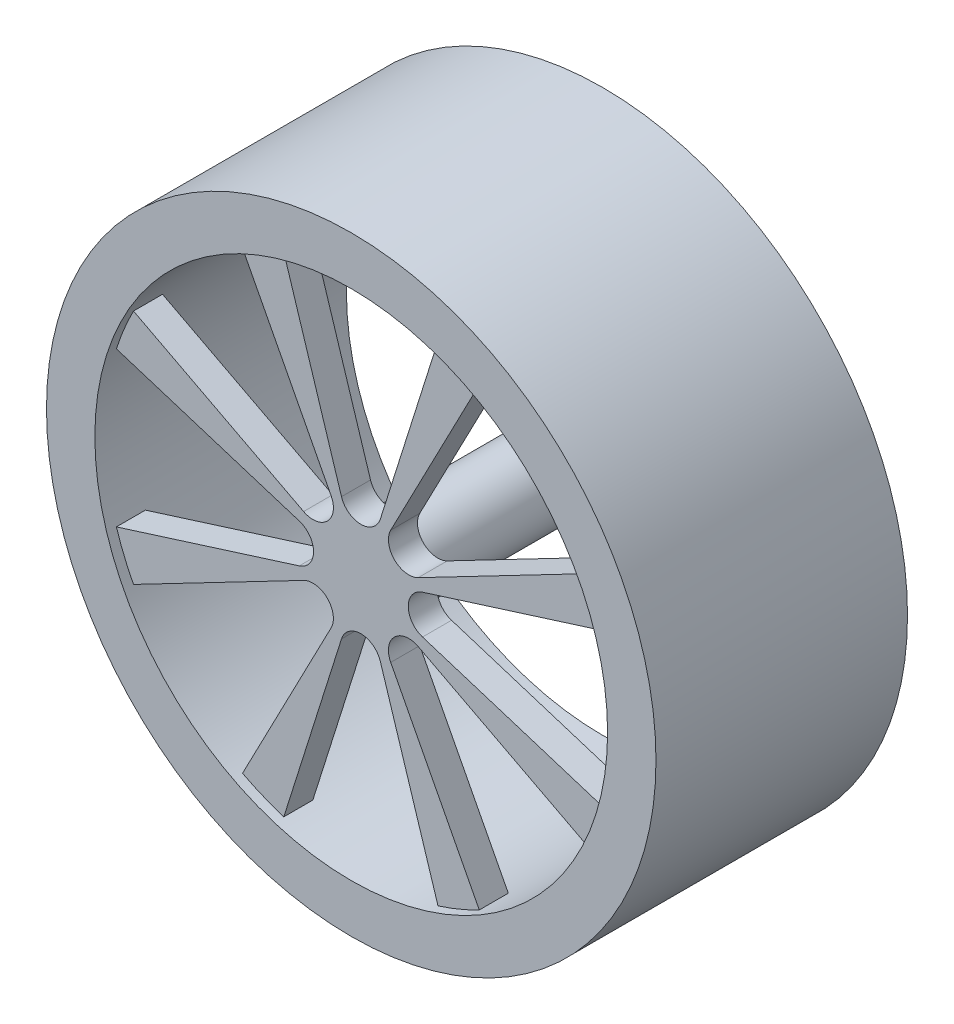
from build123d import *

# Parameters (mm, degrees)
ESQUISSE1_R             = 31.5
BOSS_EXTRU_1_DEPTH      = 26
ESQUISSE2_R             = 26.5
ENL_V_MAT_EXTRU_1_DEPTH = 1
ENL_V_MAT_EXTRU_2_DEPTH = 52.083265362
ESQUISSE4_R             = 26.5
ENL_V_MAT_EXTRU_3_DEPTH = 21
ESQUISSE5_R             = 4
BOSS_EXTRU_2_DEPTH      = 22
ESQUISSE6_R             = 2
ENL_V_MAT_EXTRU_4_DEPTH = 5


with BuildPart() as part:
    # Esquisse1 → Boss.-Extru.1 (new body)
    with BuildSketch(Plane.XY):
        with Locations(Location((0, 0, 0), (0, 0, 180))):
            Circle(ESQUISSE1_R)
    extrude(amount=BOSS_EXTRU_1_DEPTH)

    # Esquisse2 → Enlèv. mat.-Extru.1 (cut)
    with BuildSketch(Plane.XY.offset(26)):
        Circle(ESQUISSE2_R)
    enl_v_mat_extru_1 = extrude(amount=-ENL_V_MAT_EXTRU_1_DEPTH, mode=Mode.SUBTRACT)

    # Symétrie1: Enlèv. mat.-Extru.1 across plane
    add(enl_v_mat_extru_1.mirror(Plane.XY.offset(13)), mode=Mode.SUBTRACT)

    # Esquisse3 → Enlèv. mat.-Extru.2 (cut, through all)
    with BuildSketch(Plane.XY.offset(25)):
        with BuildLine():
            ThreePointArc((7.968703687, 25.273499195), (0, 26.5), (-7.968703687, 25.273499195))
            Line((-7.968703687, 25.273499195), (-2.007517527, 6.367032155))
            ThreePointArc((-2.007517527, 6.367032155), (0, 4.895059403), (2.007517527, 6.367032155))
            Line((2.007517527, 6.367032155), (7.968703687, 25.273499195))
        make_face()
        with BuildLine():
            Line((-3.082642356, 5.92170087), (-12.236338251, 23.505787079))
            ThreePointArc((-12.236338251, 23.505787079), (-18.738329701, 18.738329701), (-23.505787079, 12.236338251))
            Line((-23.505787079, 12.236338251), (-5.92170087, 3.082642356))
            ThreePointArc((-5.92170087, 3.082642356), (-3.461329699, 3.461329699), (-3.082642356, 5.92170087))
        make_face()
        with BuildLine():
            Line((-6.367032155, 2.007517527), (-25.273499195, 7.968703687))
            ThreePointArc((-25.273499195, 7.968703687), (-26.5, 0), (-25.273499195, -7.968703687))
            Line((-25.273499195, -7.968703687), (-6.367032155, -2.007517527))
            ThreePointArc((-6.367032155, -2.007517527), (-4.895059403, 0), (-6.367032155, 2.007517527))
        make_face()
        with BuildLine():
            Line((-5.92170087, -3.082642356), (-23.505787079, -12.236338251))
            ThreePointArc((-23.505787079, -12.236338251), (-18.738329701, -18.738329701), (-12.236338251, -23.505787079))
            Line((-12.236338251, -23.505787079), (-3.082642356, -5.92170087))
            ThreePointArc((-3.082642356, -5.92170087), (-3.461329699, -3.461329699), (-5.92170087, -3.082642356))
        make_face()
        with BuildLine():
            Line((-2.007517527, -6.367032155), (-7.968703687, -25.273499195))
            ThreePointArc((-7.968703687, -25.273499195), (0, -26.5), (7.968703687, -25.273499195))
            Line((7.968703687, -25.273499195), (2.007517527, -6.367032155))
            ThreePointArc((2.007517527, -6.367032155), (0, -4.895059403), (-2.007517527, -6.367032155))
        make_face()
        with BuildLine():
            ThreePointArc((12.236338251, -23.505787079), (18.738329701, -18.738329701), (23.505787079, -12.236338251))
            Line((23.505787079, -12.236338251), (5.92170087, -3.082642356))
            ThreePointArc((5.92170087, -3.082642356), (3.461329699, -3.461329699), (3.082642356, -5.92170087))
            Line((3.082642356, -5.92170087), (12.236338251, -23.505787079))
        make_face()
        with BuildLine():
            ThreePointArc((26.5, 0), (26.191580027, 4.031269734), (25.273499195, 7.968703687))
            Line((25.273499195, 7.968703687), (6.367032155, 2.007517527))
            ThreePointArc((6.367032155, 2.007517527), (4.895059403, 0), (6.367032155, -2.007517527))
            Line((6.367032155, -2.007517527), (25.273499195, -7.968703687))
            ThreePointArc((25.273499195, -7.968703687), (26.191580027, -4.031269734), (26.5, 0))
        make_face()
        with BuildLine():
            ThreePointArc((23.505787079, 12.236338251), (18.738329701, 18.738329701), (12.236338251, 23.505787079))
            Line((12.236338251, 23.505787079), (3.082642356, 5.92170087))
            ThreePointArc((3.082642356, 5.92170087), (3.461329699, 3.461329699), (5.92170087, 3.082642356))
            Line((5.92170087, 3.082642356), (23.505787079, 12.236338251))
        make_face()
    extrude(amount=-ENL_V_MAT_EXTRU_2_DEPTH, mode=Mode.SUBTRACT)

    # Esquisse4 → Enlèv. mat.-Extru.3 (cut)
    with BuildSketch(Plane(origin=(0, 0, 1), x_dir=(-1, 0, 0), z_dir=(0, 0, -1))):
        with Locations(Location((0, 0, 0), (0, 0, 180))):
            Circle(ESQUISSE4_R)
    extrude(amount=-ENL_V_MAT_EXTRU_3_DEPTH, mode=Mode.SUBTRACT)

    # Esquisse5 → Boss.-Extru.2 (add)
    with BuildSketch(Plane(origin=(0, 0, 22), x_dir=(-1, 0, 0), z_dir=(0, 0, -1))):
        with Locations(Location((0, 0, 0), (0, 0, 180))):
            Circle(ESQUISSE5_R)
    extrude(amount=BOSS_EXTRU_2_DEPTH)

    # Esquisse6 → Enlèv. mat.-Extru.4 (cut)
    with BuildSketch(Plane(origin=(0, 0, 0), x_dir=(-1, 0, 0), z_dir=(0, 0, -1))):
        Circle(ESQUISSE6_R)
    extrude(amount=-ENL_V_MAT_EXTRU_4_DEPTH, mode=Mode.SUBTRACT)


solid = part.part
